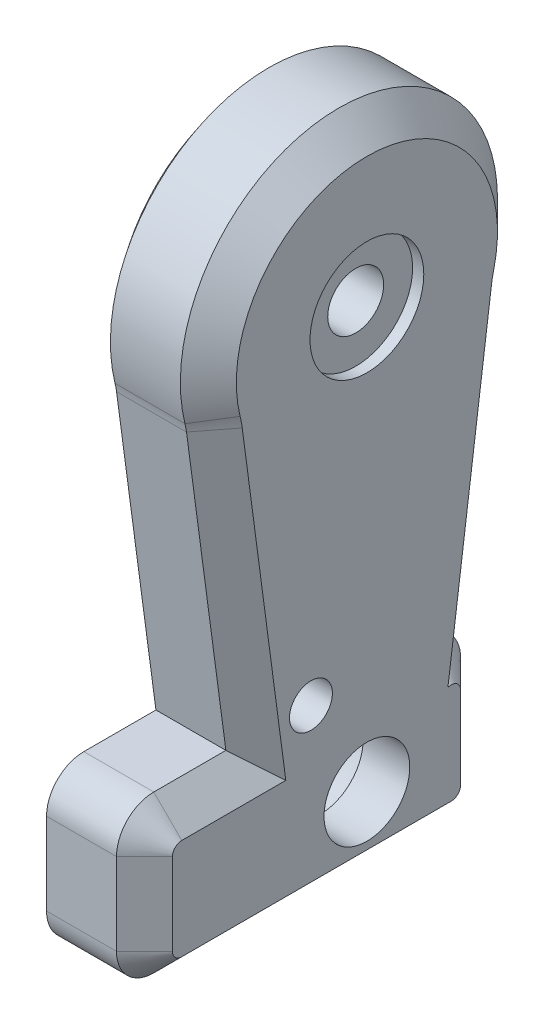
from build123d import *

# Parameters (mm, degrees)
BOSS_EXTRUDE1_START  = 65.9
BOSS_EXTRUDE1_DEPTH  = 10.5
BOSS_EXTRUDE2_START  = 65.8
BOSS_EXTRUDE2_DEPTH  = 0.6
CHAMFER1_SIZE        = 3
CHAMFER2_SIZE        = 3
BOSS_EXTRUDE3_START  = 62.7
SKETCH3_W            = 2.3
SKETCH3_H            = 23
BOSS_EXTRUDE3_DEPTH  = 6.6
BOSS_EXTRUDE4_START  = 54.5
SKETCH4_W            = 2.3
SKETCH4_H            = 6.6
BOSS_EXTRUDE4_DEPTH  = 23
BOSS_EXTRUDE5_START  = 65.9
SKETCH5_R            = 4.6
BOSS_EXTRUDE5_DEPTH  = 2.3
BOSS_EXTRUDE6_START  = 75.2
SKETCH6_R            = 6.1
BOSS_EXTRUDE6_DEPTH  = 1.7
BOSS_EXTRUDE7_START  = 68.1
SKETCH7_R            = 3
BOSS_EXTRUDE7_DEPTH  = 7.2
BOSS_EXTRUDE8_START  = 65.1
SKETCH8_W            = 6.1
SKETCH8_H            = 1.1
BOSS_EXTRUDE8_DEPTH  = 1.8
BOSS_EXTRUDE9_START  = 71.5
SKETCH9_W            = 6.1
SKETCH9_H            = 1.8
BOSS_EXTRUDE9_DEPTH  = 1.1
BOSS_EXTRUDE10_START = 65.1
SKETCH10_W           = 6.1
SKETCH10_H           = 1.1
BOSS_EXTRUDE10_DEPTH = 1.8
BOSS_EXTRUDE11_START = 59.4
SKETCH11_W           = 6.1
SKETCH11_H           = 1.8
BOSS_EXTRUDE11_DEPTH = 1.1
BOSS_EXTRUDE12_START = 65.1
SKETCH12_W           = 7.3
SKETCH12_H           = 3.4
BOSS_EXTRUDE12_DEPTH = 1.8
BOSS_EXTRUDE13_START = 72.6
SKETCH13_W           = 7.3
SKETCH13_H           = 1.8
BOSS_EXTRUDE13_DEPTH = 3.4
BOSS_EXTRUDE14_START = 65.1
SKETCH14_W           = 7.3
SKETCH14_H           = 3.4
BOSS_EXTRUDE14_DEPTH = 1.8
BOSS_EXTRUDE15_START = 56
SKETCH15_W           = 7.3
SKETCH15_H           = 1.8
BOSS_EXTRUDE15_DEPTH = 3.4
BOSS_EXTRUDE16_START = 64.4
BOSS_EXTRUDE16_DEPTH = 2.05
BOSS_EXTRUDE17_START = 55.875
SKETCH17_W           = 4.1
SKETCH17_H           = 2
BOSS_EXTRUDE17_DEPTH = 2.9
BOSS_EXTRUDE18_START = 84.025
SKETCH18_W           = 4.1
SKETCH18_H           = 2
BOSS_EXTRUDE18_DEPTH = 2.9
BOSS_EXTRUDE19_START = 59.7
SKETCH19_W           = 2.1
SKETCH19_H           = 13
BOSS_EXTRUDE19_DEPTH = 23.4
BOSS_EXTRUDE20_START = 66.3
SKETCH20_R           = 6.7
BOSS_EXTRUDE20_DEPTH = 5.1
BOSS_EXTRUDE21_START = 71.1
SKETCH21_R           = 4.6
BOSS_EXTRUDE21_DEPTH = 5.8
BOSS_EXTRUDE22_START = 63
SKETCH22_W           = 8.3
SKETCH22_H           = 20.8
BOSS_EXTRUDE22_DEPTH = 6
BOSS_EXTRUDE23_START = 70.9
SKETCH23_R           = 2.3
BOSS_EXTRUDE23_DEPTH = 6
BOSS_EXTRUDE24_START = 66.3
SKETCH24_R           = 1.3
BOSS_EXTRUDE24_DEPTH = 4.65
BOSS_EXTRUDE25_START = 57.4
SKETCH25_W           = 4.1
SKETCH25_H           = 4.1
BOSS_EXTRUDE25_DEPTH = 2.2
BOSS_EXTRUDE26_START = -47.75
BOSS_EXTRUDE26_DEPTH = 3.5
BOSS_EXTRUDE27_START = 72.4
SKETCH27_W           = 4.1
SKETCH27_H           = 4.1
BOSS_EXTRUDE27_DEPTH = 2.2
BOSS_EXTRUDE28_START = -47.75
BOSS_EXTRUDE28_DEPTH = 3.5


with BuildPart() as part:
    # Sketch1 → Boss-Extrude1 (new body)
    with BuildSketch(Plane(origin=(0, 0, 0), x_dir=(0, 0, -1), z_dir=(1, 0, 0)).offset(BOSS_EXTRUDE1_START)):
        with BuildLine():
            Line((-49.657293521, -24.929701405), (-54.04649339, -57.848700423))
            ThreePointArc((-54.04649339, -57.848700423), (-53.234221048, -59.119126346), (-52.95, -60.6))
            Line((-52.95, -60.6), (-52.95, -69.4))
            ThreePointArc((-52.95, -69.4), (-54.121572875, -72.228427125), (-56.95, -73.4))
            Line((-56.95, -73.4), (-85.85, -73.4))
            ThreePointArc((-85.85, -73.4), (-88.678427125, -72.228427125), (-89.85, -69.4))
            Line((-89.85, -69.4), (-89.85, -60.6))
            ThreePointArc((-89.85, -60.6), (-88.678427125, -57.771572875), (-85.85, -56.6))
            Line((-85.85, -56.6), (-78.12, -56.6))
            Line((-78.12, -56.6), (-82.342706479, -24.929701405))
            ThreePointArc((-82.342706479, -24.929701405), (-82.412282932, -24.49821266), (-82.505320186, -24.071167593))
            ThreePointArc((-82.505320186, -24.071167593), (-66, -3), (-49.494679814, -24.071167593))
            ThreePointArc((-49.494679814, -24.071167593), (-49.587717068, -24.49821266), (-49.657293521, -24.929701405))
        make_face()
    extrude(amount=BOSS_EXTRUDE1_DEPTH)


with BuildPart() as body_2:
    # Sketch2 → Boss-Extrude2 (new body)
    with BuildSketch(Plane(origin=(0, 0, 0), x_dir=(0, 0, -1), z_dir=(1, 0, 0)).offset(BOSS_EXTRUDE2_START)):
        with BuildLine():
            Line((-50.450275841, -24.823970429), (-54.893518409, -58.148289686))
            ThreePointArc((-54.893518409, -58.148289686), (-54.049936113, -59.247362039), (-53.75, -60.6))
            Line((-53.75, -60.6), (-53.75, -69.4))
            ThreePointArc((-53.75, -69.4), (-54.6872583, -71.6627417), (-56.95, -72.6))
            Line((-56.95, -72.6), (-85.85, -72.6))
            ThreePointArc((-85.85, -72.6), (-88.1127417, -71.6627417), (-89.05, -69.4))
            Line((-89.05, -69.4), (-89.05, -60.6))
            ThreePointArc((-89.05, -60.6), (-88.1127417, -58.3372583), (-85.85, -57.4))
            Line((-85.85, -57.4), (-77.206253549, -57.4))
            Line((-77.206253549, -57.4), (-81.549724159, -24.823970429))
            ThreePointArc((-81.549724159, -24.823970429), (-81.626258257, -24.34933281), (-81.728599236, -23.879583236))
            ThreePointArc((-81.728599236, -23.879583236), (-66, -3.8), (-50.271400764, -23.879583236))
            ThreePointArc((-50.271400764, -23.879583236), (-50.373741743, -24.34933281), (-50.450275841, -24.823970429))
        make_face()
    extrude(amount=BOSS_EXTRUDE2_DEPTH)


with BuildPart() as part_1:
    add(part.part)

    # Combine1: cut body 2
    add(body_2.part, mode=Mode.SUBTRACT)

    # Chamfer1
    chamfer1_edges = [part_1.edges().sort_by_distance(p)[0] for p in [
        (76.4, -41.389200914, 51.851893455),
        (76.4, -24.49821266, 49.587717068),
        (76.4, -24.49821266, 82.412282932),
        (76.4, -3, 66),
        (76.4, -40.764850703, 80.23135324),
    ]]
    chamfer(chamfer1_edges, length=CHAMFER1_SIZE)

    # Chamfer2
    chamfer2_edges = [part_1.edges().sort_by_distance(p)[0] for p in [
        (76.4, -56.6, 80.471725405),
        (76.4, -57.771572875, 88.678427125),
        (76.4, -57.786965833, 54.106263237),
        (76.4, -65, 89.85),
        (76.4, -65, 52.95),
        (76.4, -72.228427125, 88.678427125),
        (76.4, -72.228427125, 54.121572875),
        (76.4, -73.4, 71.4),
    ]]
    chamfer(chamfer2_edges, length=CHAMFER2_SIZE)


with BuildPart() as body_2_2:
    # Sketch3 → Boss-Extrude3 (new body)
    with BuildSketch(Plane.XY.offset(BOSS_EXTRUDE3_START)):
        with Locations((67.05, -20)):
            Rectangle(SKETCH3_W, SKETCH3_H)
    extrude(amount=BOSS_EXTRUDE3_DEPTH)


with BuildPart() as part_2:
    add(part_1.part)

    # Combine2: cut body 2 2
    add(body_2_2.part, mode=Mode.SUBTRACT)


with BuildPart() as body_2_3:
    # Sketch4 → Boss-Extrude4 (new body)
    with BuildSketch(Plane.XY.offset(BOSS_EXTRUDE4_START)):
        with Locations((67.05, -20)):
            Rectangle(SKETCH4_W, SKETCH4_H)
    extrude(amount=BOSS_EXTRUDE4_DEPTH)


with BuildPart() as part_3:
    add(part_2.part)

    # Combine3: cut body 2 3
    add(body_2_3.part, mode=Mode.SUBTRACT)


with BuildPart() as body_2_4:
    # Sketch5 → Boss-Extrude5 (new body)
    with BuildSketch(Plane(origin=(0, 0, 0), x_dir=(0, 0, -1), z_dir=(1, 0, 0)).offset(BOSS_EXTRUDE5_START)):
        with Locations((-66, -20)):
            Circle(SKETCH5_R)
    extrude(amount=BOSS_EXTRUDE5_DEPTH)


with BuildPart() as part_4:
    add(part_3.part)

    # Combine4: cut body 2 4
    add(body_2_4.part, mode=Mode.SUBTRACT)


with BuildPart() as body_2_5:
    # Sketch6 → Boss-Extrude6 (new body)
    with BuildSketch(Plane(origin=(0, 0, 0), x_dir=(0, 0, -1), z_dir=(1, 0, 0)).offset(BOSS_EXTRUDE6_START)):
        with Locations((-66, -20)):
            Circle(SKETCH6_R)
    extrude(amount=BOSS_EXTRUDE6_DEPTH)


with BuildPart() as part_5:
    add(part_4.part)

    # Combine5: cut body 2 5
    add(body_2_5.part, mode=Mode.SUBTRACT)


with BuildPart() as body_2_6:
    # Sketch7 → Boss-Extrude7 (new body)
    with BuildSketch(Plane(origin=(0, 0, 0), x_dir=(0, 0, -1), z_dir=(1, 0, 0)).offset(BOSS_EXTRUDE7_START)):
        with Locations((-66, -20)):
            Circle(SKETCH7_R)
    extrude(amount=BOSS_EXTRUDE7_DEPTH)


with BuildPart() as part_6:
    add(part_5.part)

    # Combine6: cut body 2 6
    add(body_2_6.part, mode=Mode.SUBTRACT)


with BuildPart() as body_2_7:
    # Sketch8 → Boss-Extrude8 (new body)
    with BuildSketch(Plane.XY.offset(BOSS_EXTRUDE8_START)):
        with Locations((71.15, -13.95)):
            Rectangle(SKETCH8_W, SKETCH8_H)
    extrude(amount=BOSS_EXTRUDE8_DEPTH)


with BuildPart() as part_7:
    add(part_6.part)

    # Combine7: cut body 2 7
    add(body_2_7.part, mode=Mode.SUBTRACT)


with BuildPart() as body_2_8:
    # Sketch9 → Boss-Extrude9 (new body)
    with BuildSketch(Plane.XY.offset(BOSS_EXTRUDE9_START)):
        with Locations((71.15, -20)):
            Rectangle(SKETCH9_W, SKETCH9_H)
    extrude(amount=BOSS_EXTRUDE9_DEPTH)


with BuildPart() as part_8:
    add(part_7.part)

    # Combine8: cut body 2 8
    add(body_2_8.part, mode=Mode.SUBTRACT)


with BuildPart() as body_2_9:
    # Sketch10 → Boss-Extrude10 (new body)
    with BuildSketch(Plane.XY.offset(BOSS_EXTRUDE10_START)):
        with Locations((71.15, -26.05)):
            Rectangle(SKETCH10_W, SKETCH10_H)
    extrude(amount=BOSS_EXTRUDE10_DEPTH)


with BuildPart() as part_9:
    add(part_8.part)

    # Combine9: cut body 2 9
    add(body_2_9.part, mode=Mode.SUBTRACT)


with BuildPart() as body_2_10:
    # Sketch11 → Boss-Extrude11 (new body)
    with BuildSketch(Plane.XY.offset(BOSS_EXTRUDE11_START)):
        with Locations((71.15, -20)):
            Rectangle(SKETCH11_W, SKETCH11_H)
    extrude(amount=BOSS_EXTRUDE11_DEPTH)


with BuildPart() as part_10:
    add(part_9.part)

    # Combine10: cut body 2 10
    add(body_2_10.part, mode=Mode.SUBTRACT)


with BuildPart() as body_2_11:
    # Sketch12 → Boss-Extrude12 (new body)
    with BuildSketch(Plane.XY.offset(BOSS_EXTRUDE12_START)):
        with Locations((71.75, -11.7)):
            Rectangle(SKETCH12_W, SKETCH12_H)
    extrude(amount=BOSS_EXTRUDE12_DEPTH)


with BuildPart() as part_11:
    add(part_10.part)

    # Combine11: cut body 2 11
    add(body_2_11.part, mode=Mode.SUBTRACT)


with BuildPart() as body_2_12:
    # Sketch13 → Boss-Extrude13 (new body)
    with BuildSketch(Plane.XY.offset(BOSS_EXTRUDE13_START)):
        with Locations((71.75, -20)):
            Rectangle(SKETCH13_W, SKETCH13_H)
    extrude(amount=BOSS_EXTRUDE13_DEPTH)


with BuildPart() as part_12:
    add(part_11.part)

    # Combine12: cut body 2 12
    add(body_2_12.part, mode=Mode.SUBTRACT)


with BuildPart() as body_2_13:
    # Sketch14 → Boss-Extrude14 (new body)
    with BuildSketch(Plane.XY.offset(BOSS_EXTRUDE14_START)):
        with Locations((71.75, -28.3)):
            Rectangle(SKETCH14_W, SKETCH14_H)
    extrude(amount=BOSS_EXTRUDE14_DEPTH)


with BuildPart() as part_13:
    add(part_12.part)

    # Combine13: cut body 2 13
    add(body_2_13.part, mode=Mode.SUBTRACT)


with BuildPart() as body_2_14:
    # Sketch15 → Boss-Extrude15 (new body)
    with BuildSketch(Plane.XY.offset(BOSS_EXTRUDE15_START)):
        with Locations((71.75, -20)):
            Rectangle(SKETCH15_W, SKETCH15_H)
    extrude(amount=BOSS_EXTRUDE15_DEPTH)


with BuildPart() as part_14:
    add(part_13.part)

    # Combine14: cut body 2 14
    add(body_2_14.part, mode=Mode.SUBTRACT)

    # Sketch16 → Boss-Extrude16 (add)
    with BuildSketch(Plane(origin=(0, 0, 0), x_dir=(0, 0, -1), z_dir=(1, 0, 0)).offset(BOSS_EXTRUDE16_START)):
        with BuildLine():
            Line((-51.904610688, -14.86969785), (-52.468426261, -15.074909936))
            ThreePointArc((-52.468426261, -15.074909936), (-66, -5.6), (-79.531573739, -15.074909936))
            Line((-79.531573739, -15.074909936), (-80.095389312, -14.86969785))
            ThreePointArc((-80.095389312, -14.86969785), (-66, -5), (-51.904610688, -14.86969785))
        make_face()
    extrude(amount=BOSS_EXTRUDE16_DEPTH)


with BuildPart() as body_2_15:
    # Sketch17 → Boss-Extrude17 (new body)
    with BuildSketch(Plane.XY.offset(BOSS_EXTRUDE17_START)):
        with Locations((68.35, -65)):
            Rectangle(SKETCH17_W, SKETCH17_H)
    extrude(amount=BOSS_EXTRUDE17_DEPTH)


with BuildPart() as part_15:
    add(part_14.part)

    # Combine15: cut body 2 15
    add(body_2_15.part, mode=Mode.SUBTRACT)


with BuildPart() as body_2_16:
    # Sketch18 → Boss-Extrude18 (new body)
    with BuildSketch(Plane.XY.offset(BOSS_EXTRUDE18_START)):
        with Locations((68.35, -65)):
            Rectangle(SKETCH18_W, SKETCH18_H)
    extrude(amount=BOSS_EXTRUDE18_DEPTH)


with BuildPart() as part_16:
    add(part_15.part)

    # Combine16: cut body 2 16
    add(body_2_16.part, mode=Mode.SUBTRACT)


with BuildPart() as body_2_17:
    # Sketch19 → Boss-Extrude19 (new body)
    with BuildSketch(Plane.XY.offset(BOSS_EXTRUDE19_START)):
        with Locations((67.35, -65)):
            Rectangle(SKETCH19_W, SKETCH19_H)
    extrude(amount=BOSS_EXTRUDE19_DEPTH)


with BuildPart() as part_17:
    add(part_16.part)

    # Combine17: cut body 2 17
    add(body_2_17.part, mode=Mode.SUBTRACT)


with BuildPart() as body_2_18:
    # Sketch20 → Boss-Extrude20 (new body)
    with BuildSketch(Plane(origin=(0, 0, 0), x_dir=(0, 0, -1), z_dir=(1, 0, 0)).offset(BOSS_EXTRUDE20_START)):
        with Locations((-66, -65)):
            Circle(SKETCH20_R)
    extrude(amount=BOSS_EXTRUDE20_DEPTH)


with BuildPart() as part_18:
    add(part_17.part)

    # Combine18: cut body 2 18
    add(body_2_18.part, mode=Mode.SUBTRACT)


with BuildPart() as body_2_19:
    # Sketch21 → Boss-Extrude21 (new body)
    with BuildSketch(Plane(origin=(0, 0, 0), x_dir=(0, 0, -1), z_dir=(1, 0, 0)).offset(BOSS_EXTRUDE21_START)):
        with Locations(Location((-66, -65, 0), (0, 0, 180))):
            Circle(SKETCH21_R)
    extrude(amount=BOSS_EXTRUDE21_DEPTH)


with BuildPart() as part_19:
    add(part_18.part)

    # Combine19: cut body 2 19
    add(body_2_19.part, mode=Mode.SUBTRACT)


with BuildPart() as body_2_20:
    # Sketch22 → Boss-Extrude22 (new body)
    with BuildSketch(Plane.XY.offset(BOSS_EXTRUDE22_START)):
        with Locations((70.45, -47.4)):
            Rectangle(SKETCH22_W, SKETCH22_H)
    extrude(amount=BOSS_EXTRUDE22_DEPTH)


with BuildPart() as part_20:
    add(part_19.part)

    # Combine20: cut body 2 20
    add(body_2_20.part, mode=Mode.SUBTRACT)


with BuildPart() as body_2_21:
    # Sketch23 → Boss-Extrude23 (new body)
    with BuildSketch(Plane(origin=(0, 0, 0), x_dir=(0, 0, -1), z_dir=(1, 0, 0)).offset(BOSS_EXTRUDE23_START)):
        with Locations((-72, -54)):
            Circle(SKETCH23_R)
    extrude(amount=BOSS_EXTRUDE23_DEPTH)


with BuildPart() as part_21:
    add(part_20.part)

    # Combine21: cut body 2 21
    add(body_2_21.part, mode=Mode.SUBTRACT)


with BuildPart() as body_2_22:
    # Sketch24 → Boss-Extrude24 (new body)
    with BuildSketch(Plane(origin=(0, 0, 0), x_dir=(0, 0, -1), z_dir=(1, 0, 0)).offset(BOSS_EXTRUDE24_START)):
        with Locations((-72, -54)):
            Circle(SKETCH24_R)
    extrude(amount=BOSS_EXTRUDE24_DEPTH)


with BuildPart() as part_22:
    add(part_21.part)

    # Combine22: cut body 2 22
    add(body_2_22.part, mode=Mode.SUBTRACT)


with BuildPart() as body_2_23:
    # Sketch25 → Boss-Extrude25 (new body)
    with BuildSketch(Plane.XY.offset(BOSS_EXTRUDE25_START)):
        with Locations((68.35, -46)):
            Rectangle(SKETCH25_W, SKETCH25_H)
    extrude(amount=BOSS_EXTRUDE25_DEPTH)


with BuildPart() as part_23:
    add(part_22.part)

    # Combine23: cut body 2 23
    add(body_2_23.part, mode=Mode.SUBTRACT)

    # Sketch26 → Boss-Extrude26 (add)
    with BuildSketch(Plane(origin=(0, 0, 0), x_dir=(1, 0, 0), z_dir=(0, 1, 0)).offset(BOSS_EXTRUDE26_START)):
        Polygon((70.6, -59), (70.6, -58), (64.4, -58), (64.4, -57.6), (63.8, -57.6), (63, -58.4), (63, -59), align=None)
    extrude(amount=BOSS_EXTRUDE26_DEPTH)


with BuildPart() as body_2_24:
    # Sketch27 → Boss-Extrude27 (new body)
    with BuildSketch(Plane.XY.offset(BOSS_EXTRUDE27_START)):
        with Locations((68.35, -46)):
            Rectangle(SKETCH27_W, SKETCH27_H)
    extrude(amount=BOSS_EXTRUDE27_DEPTH)


with BuildPart() as part_24:
    add(part_23.part)

    # Combine24: cut body 2 24
    add(body_2_24.part, mode=Mode.SUBTRACT)

    # Sketch28 → Boss-Extrude28 (add)
    with BuildSketch(Plane(origin=(0, 0, 0), x_dir=(1, 0, 0), z_dir=(0, 1, 0)).offset(BOSS_EXTRUDE28_START)):
        Polygon((70.6, -73), (70.6, -74), (64.4, -74), (64.4, -74.4), (63.8, -74.4), (63, -73.6), (63, -73), align=None)
    extrude(amount=BOSS_EXTRUDE28_DEPTH)


solid = part_24.part
